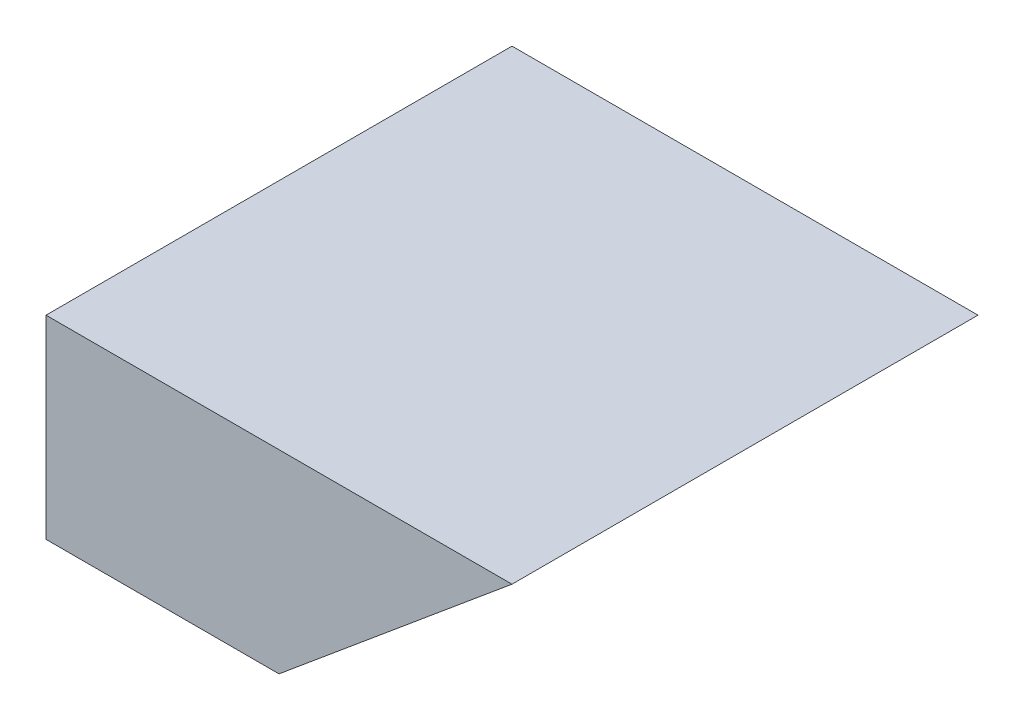
from build123d import *

# Parameters (mm, degrees)
SKETCH_1_W          = 120
SKETCH_1_H          = 120
EXTRUDE_1_DEPTH     = 50
CUT_EXTRUDE_1_DEPTH = 144.178210633


with BuildPart() as part:
    # 草图1 → 凸台-拉伸1 (new body)
    with BuildSketch(Plane(origin=(0, 0, 0), x_dir=(1, 0, 0), z_dir=(0, 1, 0))):
        Rectangle(SKETCH_1_W, SKETCH_1_H)
    extrude(amount=EXTRUDE_1_DEPTH)

    # 草图2 → 切除-拉伸1 (cut, through all)
    with BuildSketch(Plane.XY.offset(60)):
        Polygon((60, 0), (0, 0), (60, 50), align=None)
    extrude(amount=-CUT_EXTRUDE_1_DEPTH, mode=Mode.SUBTRACT)


solid = part.part
